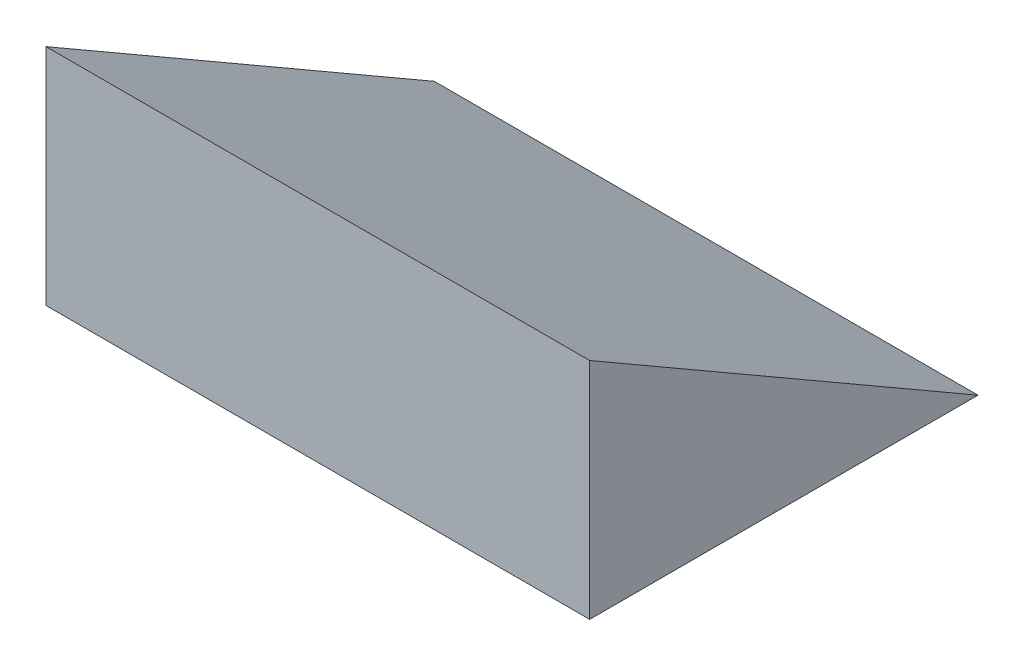
from build123d import *

# Parameters (mm, degrees)
BOSS_EXTRUDE1_DEPTH = 14


with BuildPart() as part:
    # Sketch1 → Boss-Extrude1 (new body)
    with BuildSketch(Plane(origin=(0, 0, 0), x_dir=(0, 0, -1), z_dir=(1, 0, 0))):
        Polygon((0, 0), (10, 0), (0, 5.773502692), align=None)
    extrude(amount=BOSS_EXTRUDE1_DEPTH)


solid = part.part
